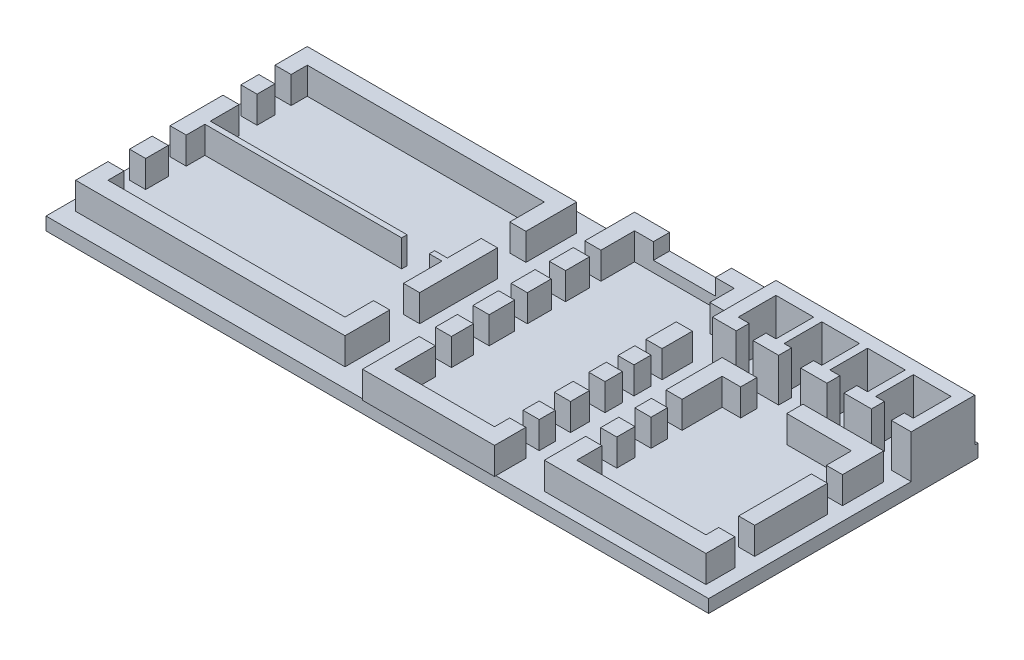
from build123d import *

# Parameters (mm, degrees)
SKETCH1_W           = 123
SKETCH1_H           = 50
BOSS_EXTRUDE1_DEPTH = 2.4
SKETCH2_W           = 50
SKETCH2_H           = 43
SKETCH2_W_2         = 44
SKETCH2_H_2         = 18
BOSS_EXTRUDE2_DEPTH = 5
SKETCH3_W           = 24.5
SKETCH3_H           = 50.5
SKETCH3_W_2         = 18.5
SKETCH3_H_2         = 44.5
BOSS_EXTRUDE3_DEPTH = 5
SKETCH4_W           = 11.5
SKETCH4_H           = 3
CUT_EXTRUDE2_DEPTH  = 3
SKETCH5_W           = 30
SKETCH5_H           = 33
SKETCH5_W_2         = 24
SKETCH5_H_2         = 27
BOSS_EXTRUDE5_DEPTH = 5
SKETCH6_W           = 36.9
SKETCH6_H           = 11.8
SKETCH6_W_2         = 7
SKETCH6_H_2         = 7
BOSS_EXTRUDE6_DEPTH = 8
SKETCH7_W           = 5.123641681
SKETCH7_H           = 1
CUT_EXTRUDE3_DEPTH  = 5
SKETCH8_W           = 3
SKETCH8_H           = 5.294429738
SKETCH8_H_2         = 5.550611822
SKETCH8_H_3         = 2.134850701
SKETCH8_H_4         = 2.647214869
SKETCH8_H_5         = 2.348335771
SKETCH8_H_6         = 2.903396953
SKETCH8_H_7         = 2.988790981
SKETCH8_H_8         = 6.233764046
SKETCH8_H_9         = 2.049456673
SKETCH8_H_10        = 2.1348507
SKETCH8_H_11        = 2.818002924
SKETCH8_H_12        = 2.476426813
SKETCH8_H_13        = 2.689911883
SKETCH8_H_14        = 2.775305911
SKETCH8_H_15        = 3.693291713
SKETCH8_W_2         = 8.561478369
SKETCH8_H_16        = 3
CUT_EXTRUDE4_DEPTH  = 5
SKETCH9_W           = 3.123120747
SKETCH9_H           = 2.4
SKETCH9_W_2         = 4.09656098
SKETCH9_W_3         = 3.163680757
SKETCH9_W_4         = 3.690960883
CUT_EXTRUDE5_DEPTH  = 8
SKETCH10_W          = 3
SKETCH10_H          = 3
SKETCH10_H_2        = 3.330367093
SKETCH10_H_3        = 4
CUT_EXTRUDE6_DEPTH  = 5


with BuildPart() as part:
    # Sketch1 → Boss-Extrude1 (new body)
    with BuildSketch(Plane(origin=(0, 0, 0), x_dir=(1, 0, 0), z_dir=(0, 1, 0))):
        with Locations((61.5, -25)):
            Rectangle(SKETCH1_W, SKETCH1_H)
    extrude(amount=BOSS_EXTRUDE1_DEPTH)

    # Sketch2 → Boss-Extrude2 (add)
    with BuildSketch(Plane(origin=(0, 2.4, 0), x_dir=(1, 0, 0), z_dir=(0, 1, 0))):
        with Locations((27, -25)):
            Rectangle(SKETCH2_W, SKETCH2_H)
        with Locations((27, -15.5)):
            Rectangle(SKETCH2_W_2, SKETCH2_H_2, mode=Mode.SUBTRACT)
        with Locations((27, -34.5)):
            Rectangle(SKETCH2_W_2, SKETCH2_H_2, mode=Mode.SUBTRACT)
    extrude(amount=BOSS_EXTRUDE2_DEPTH)

    # Sketch3 → Boss-Extrude3 (add)
    with BuildSketch(Plane(origin=(0, 2.4, 0), x_dir=(1, 0, 0), z_dir=(0, 1, 0))):
        with Locations((71.25, -25)):
            Rectangle(SKETCH3_W, SKETCH3_H)
        with Locations((71.25, -25)):
            Rectangle(SKETCH3_W_2, SKETCH3_H_2, mode=Mode.SUBTRACT)
    extrude(amount=BOSS_EXTRUDE3_DEPTH)

    # Sketch4 → Cut-Extrude2 (cut)
    with BuildSketch(Plane(origin=(0, 7.4, 0), x_dir=(1, 0, 0), z_dir=(0, 1, 0))):
        with Locations((71.25, -1.25)):
            Rectangle(SKETCH4_W, SKETCH4_H)
    extrude(amount=-CUT_EXTRUDE2_DEPTH, mode=Mode.SUBTRACT)

    # Sketch5 → Boss-Extrude5 (add)
    with BuildSketch(Plane(origin=(0, 2.4, 0), x_dir=(1, 0, 0), z_dir=(0, 1, 0))):
        with Locations((105.5, -31.5)):
            Rectangle(SKETCH5_W, SKETCH5_H)
        with Locations((105.5, -31.5)):
            Rectangle(SKETCH5_W_2, SKETCH5_H_2, mode=Mode.SUBTRACT)
    extrude(amount=BOSS_EXTRUDE5_DEPTH)

    # Sketch6 → Boss-Extrude6 (add)
    with BuildSketch(Plane(origin=(0, 2.4, 0), x_dir=(1, 0, 0), z_dir=(0, 1, 0))):
        with Locations((104.55, -6.5)):
            Rectangle(SKETCH6_W, SKETCH6_H)
        with Locations((92, -6.5)):
            Rectangle(SKETCH6_W_2, SKETCH6_H_2, mode=Mode.SUBTRACT)
        with Locations((100.5, -6.5)):
            Rectangle(SKETCH6_W_2, SKETCH6_H_2, mode=Mode.SUBTRACT)
        with Locations((109, -6.5)):
            Rectangle(SKETCH6_W_2, SKETCH6_H_2, mode=Mode.SUBTRACT)
        with Locations((117.5, -6.5)):
            Rectangle(SKETCH6_W_2, SKETCH6_H_2, mode=Mode.SUBTRACT)
    extrude(amount=BOSS_EXTRUDE6_DEPTH)

    # Sketch7 → Cut-Extrude3 (cut)
    with BuildSketch(Plane(origin=(0, 7.4, 0), x_dir=(1, 0, 0), z_dir=(0, 1, 0))):
        with Locations((44.079618283, -25)):
            Rectangle(SKETCH7_W, SKETCH7_H)
    extrude(amount=-CUT_EXTRUDE3_DEPTH, mode=Mode.SUBTRACT)

    # Sketch8 → Cut-Extrude4 (cut)
    with BuildSketch(Plane(origin=(0, 7.4, 0), x_dir=(1, 0, 0), z_dir=(0, 1, 0))):
        with Locations((50.5, -15.563959903)):
            Rectangle(SKETCH8_W, SKETCH8_H)
        with Locations((50.5, -35.418071419)):
            Rectangle(SKETCH8_W, SKETCH8_H_2)
        with Locations((60.5, -10.056045096)):
            Rectangle(SKETCH8_W, SKETCH8_H_3)
        with Locations((60.5, -16.887567338)):
            Rectangle(SKETCH8_W, SKETCH8_H_4)
        with Locations((60.5, -23.825832115)):
            Rectangle(SKETCH8_W, SKETCH8_H_5)
        with Locations((60.5, -31.191067032)):
            Rectangle(SKETCH8_W, SKETCH8_H_6)
        with Locations((60.5, -38.236074344)):
            Rectangle(SKETCH8_W, SKETCH8_H_7)
        with Locations((82, -10.397621207)):
            Rectangle(SKETCH8_W, SKETCH8_H_8)
        with Locations((82, -20.175237417)):
            Rectangle(SKETCH8_W, SKETCH8_H_9)
        with Locations((82, -25.42697014)):
            Rectangle(SKETCH8_W, SKETCH8_H_10)
        with Locations((82, -31.191067032)):
            Rectangle(SKETCH8_W, SKETCH8_H_6)
        with Locations((82, -37.55292212)):
            Rectangle(SKETCH8_W, SKETCH8_H_11)
        with Locations((82, -43.188927969)):
            Rectangle(SKETCH8_W, SKETCH8_H_12)
        with Locations((92, -26.771926082)):
            Rectangle(SKETCH8_W, SKETCH8_H_13)
        with Locations((92, -32.685462523)):
            Rectangle(SKETCH8_W, SKETCH8_H_7)
        with Locations((92, -38.940575076)):
            Rectangle(SKETCH8_W, SKETCH8_H_14)
        with Locations((119, -40.787220932)):
            Rectangle(SKETCH8_W, SKETCH8_H_15)
        with Locations((119, -24.039317184)):
            Rectangle(SKETCH8_W, SKETCH8_H_14)
        with Locations((101.219260816, -16.5)):
            Rectangle(SKETCH8_W_2, SKETCH8_H_16)
    extrude(amount=-CUT_EXTRUDE4_DEPTH, mode=Mode.SUBTRACT)

    # Sketch9 → Cut-Extrude5 (cut)
    with BuildSketch(Plane(origin=(0, 10.4, 0), x_dir=(1, 0, 0), z_dir=(0, 1, 0))):
        with Locations((92.086007163, -11.2)):
            Rectangle(SKETCH9_W, SKETCH9_H)
        with Locations((100.441369161, -11.2)):
            Rectangle(SKETCH9_W_2, SKETCH9_H)
        with Locations((108.938691194, -11.2)):
            Rectangle(SKETCH9_W_3, SKETCH9_H)
        with Locations((117.476573236, -11.2)):
            Rectangle(SKETCH9_W_4, SKETCH9_H)
    extrude(amount=-CUT_EXTRUDE5_DEPTH, mode=Mode.SUBTRACT)

    # Sketch10 → Cut-Extrude6 (cut)
    with BuildSketch(Plane(origin=(0, 7.4, 0), x_dir=(1, 0, 0), z_dir=(0, 1, 0))):
        with Locations((3.5, -11)):
            Rectangle(SKETCH10_W, SKETCH10_H)
        with Locations((3.5, -17.485325534)):
            Rectangle(SKETCH10_W, SKETCH10_H_2)
        with Locations((3.5, -30.63600585)):
            Rectangle(SKETCH10_W, SKETCH10_H_2)
        with Locations((3.5, -38.5)):
            Rectangle(SKETCH10_W, SKETCH10_H_3)
    extrude(amount=-CUT_EXTRUDE6_DEPTH, mode=Mode.SUBTRACT)


solid = part.part
